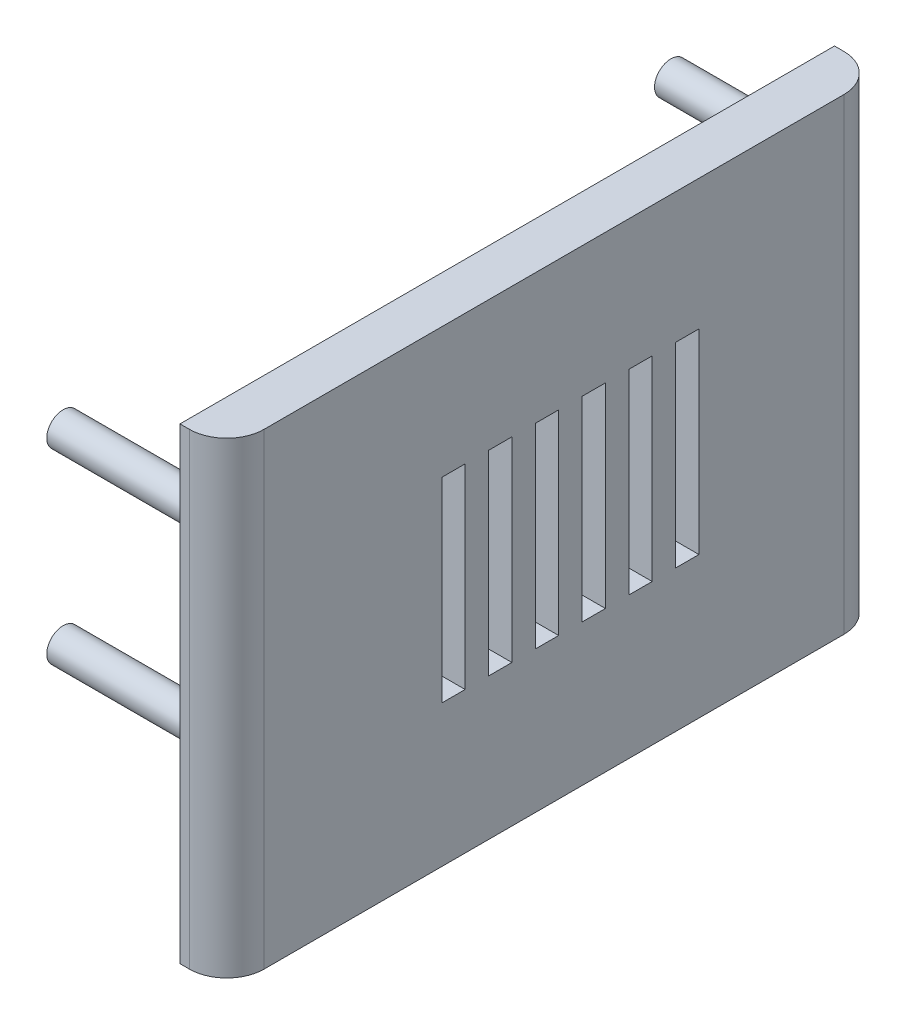
from build123d import *

# Parameters (mm, degrees)
SKETCH2_W           = 140
SKETCH2_H           = 100
BOSS_EXTRUDE1_DEPTH = 10
SKETCH3_R           = 3.5
BOSS_EXTRUDE2_DEPTH = 30
FILLET1_R           = 8
SKETCH4_W           = 5
SKETCH4_H           = 41.8
CUT_EXTRUDE1_DEPTH  = 30


with BuildPart() as part:
    # Sketch2 → Boss-Extrude1 (new body)
    with BuildSketch(Plane(origin=(0, 0, 0), x_dir=(0, 0, -1), z_dir=(1, 0, 0))):
        Rectangle(SKETCH2_W, SKETCH2_H)
    extrude(amount=BOSS_EXTRUDE1_DEPTH)

    # Sketch3 → Boss-Extrude2 (add)
    with BuildSketch(Plane.ZY):
        with Locations(Location((-65, 31.6267322, 0), (0, 0, 180))):
            Circle(SKETCH3_R)
        with Locations(Location((-65, -8.3732678, 0), (0, 0, 180))):
            Circle(SKETCH3_R)
        with Locations(Location((65, 31.6267322, 0), (0, 0, 180))):
            Circle(SKETCH3_R)
        with Locations(Location((65, -8.3732678, 0), (0, 0, 180))):
            Circle(SKETCH3_R)
    extrude(amount=BOSS_EXTRUDE2_DEPTH)

    # Fillet1
    fillet1_edges = [part.edges().sort_by_distance(p)[0] for p in [
        (10, 0, -70),
        (10, 0, 70),
    ]]
    fillet(fillet1_edges, radius=FILLET1_R)

    # Sketch4 → Cut-Extrude1 (cut)
    with BuildSketch(Plane(origin=(10, 0, 0), x_dir=(0, 0, -1), z_dir=(1, 0, 0))):
        with Locations((18.5, 1.2)):
            Rectangle(SKETCH4_W, SKETCH4_H)
        with Locations((28.5, 1.2)):
            Rectangle(SKETCH4_W, SKETCH4_H)
        with Locations((-1.5, 1.2)):
            Rectangle(SKETCH4_W, SKETCH4_H)
        with Locations((8.5, 1.2)):
            Rectangle(SKETCH4_W, SKETCH4_H)
        with Locations((-21.5, 1.2)):
            Rectangle(SKETCH4_W, SKETCH4_H)
        with Locations((-11.5, 1.2)):
            Rectangle(SKETCH4_W, SKETCH4_H)
    extrude(amount=-CUT_EXTRUDE1_DEPTH, mode=Mode.SUBTRACT)


solid = part.part
